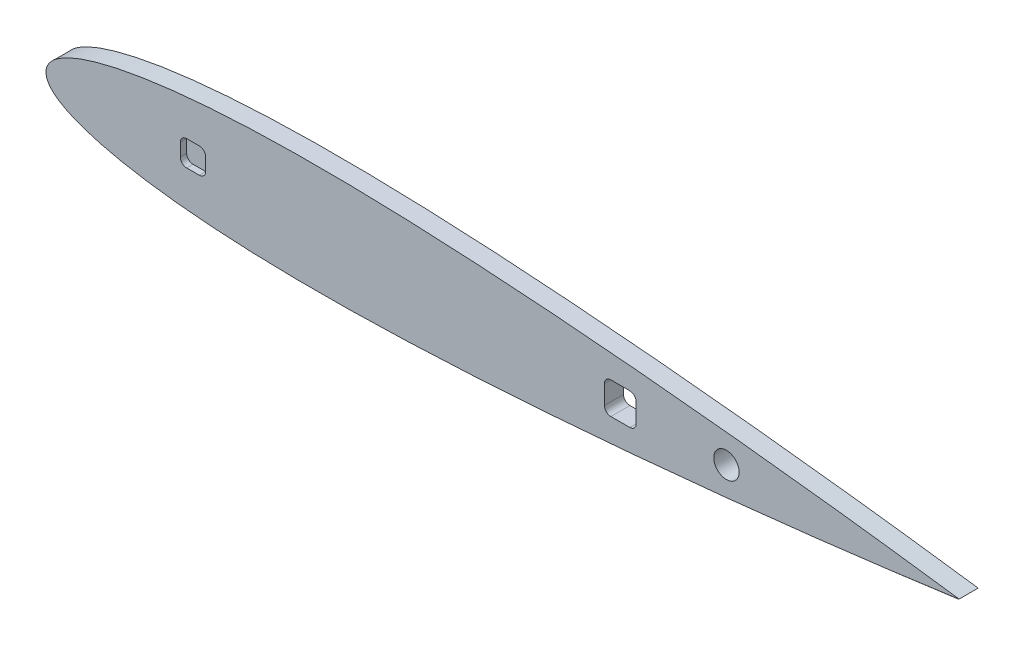
from build123d import *

# Parameters (mm, degrees)
ESBO_O2_R                = 4
RESSALTO_EXTRUS_O1_DEPTH = 6
CORTE_EXTRUS_O1_DEPTH    = 2
CORTE_EXTRUS_O2_DEPTH    = 2


with BuildPart() as part:
    # Esboço2 → Ressalto-extrusão1 (new body)
    with BuildSketch(Plane.XY):
        with BuildLine():
            add(Edge.make_bspline(
                [(287.6, 0), (287.6, 0.119697914), (285.817754553, 0.247185692), (284.767865992, 0.398094711), (284.264448894, 0.467820009), (283.43768813, 0.583773245), (282.277829485, 0.74507406), (280.793202236, 0.949881536), (278.98510147, 1.198450267), (276.858420544, 1.488091926), (274.417893217, 1.816930381), (271.669401999, 2.183559584), (268.619301696, 2.585347237), (265.274709704, 3.020406095), (261.643364865, 3.485243955), (257.733807871, 3.97868529), (253.555140371, 4.49727783), (249.117159969, 5.038339365), (244.430264247, 5.599454736), (239.5053681, 6.177691953), (234.353792881, 6.769587119), (228.987863488, 7.373628638), (223.419943837, 7.985483384), (217.663214551, 8.603508067), (211.730895239, 9.223286141), (205.636969584, 9.843669103), (199.39559532, 10.459873108), (193.021447659, 11.069962818), (186.529328525, 11.669700875), (179.934382421, 12.257126539), (173.252052511, 12.827383605), (166.497911298, 13.377921429), (159.687818769, 13.905224154), (152.837593287, 14.405058832), (145.963333172, 14.874290612), (139.081085422, 15.309171286), (132.20678029, 15.70550096), (125.35660044, 16.060145436), (118.546388357, 16.369233), (111.792105265, 16.629320446), (105.10962701, 16.837520337), (98.514511855, 16.990129218), (92.022156597, 17.084456768), (85.647566419, 17.117851746), (79.405754471, 17.088329774), (73.311328939, 16.994563536), (67.378571016, 16.833719315), (61.62120467, 16.606508882), (56.052663957, 16.311299689), (50.685913151, 15.948919147), (45.533589734, 15.519442809), (40.60767255, 15.02365128), (35.919607131, 14.463425319), (31.480201299, 13.841042083), (27.299913239, 13.157661743), (23.388323375, 12.416699746), (19.754434178, 11.620942186), (16.40673833, 10.773086642), (13.352633209, 9.876931334), (10.598853103, 8.935452398), (8.151270602, 7.951901503), (6.014730805, 6.929116001), (4.1933041, 5.869225283), (2.689111463, 4.774026072), (1.505059401, 3.641716827), (0.644003291, 2.469089904), (0.117552225, 1.250413641), (-0.057299877, 0), (0.117552225, -1.250413641), (0.644003291, -2.469089904), (1.505059401, -3.641716827), (2.689111463, -4.774026072), (4.1933041, -5.869225283), (6.014730805, -6.929116001), (8.151270602, -7.951901503), (10.598853103, -8.935452398), (13.352633209, -9.876931334), (16.40673833, -10.773086642), (19.754434178, -11.620942186), (23.388323375, -12.416699746), (27.299913239, -13.157661743), (31.480201299, -13.841042083), (35.919607131, -14.463425319), (40.60767255, -15.02365128), (45.533589734, -15.519442809), (50.685913151, -15.948919147), (56.052663957, -16.311299689), (61.62120467, -16.606508882), (67.378571016, -16.833719315), (73.311328939, -16.994563536), (79.405754471, -17.088329774), (85.647566419, -17.117851746), (92.022156597, -17.084456768), (98.514511855, -16.990129218), (105.10962701, -16.837520337), (111.792105265, -16.629320446), (118.546388357, -16.369233), (125.35660044, -16.060145436), (132.20678029, -15.70550096), (139.081085422, -15.309171286), (145.963333172, -14.874290612), (152.837593287, -14.405058832), (159.687818769, -13.905224154), (166.497911298, -13.377921429), (173.252052511, -12.827383605), (179.934382421, -12.257126539), (186.529328525, -11.669700875), (193.021447659, -11.069962818), (199.39559532, -10.459873108), (205.636969584, -9.843669103), (211.730895239, -9.223286141), (217.663214551, -8.603508067), (223.419943837, -7.985483384), (228.987863488, -7.373628638), (234.353792881, -6.769587119), (239.5053681, -6.177691953), (244.430264247, -5.599454736), (249.117159969, -5.038339365), (253.555140371, -4.49727783), (257.733807871, -3.97868529), (261.643364865, -3.485243955), (265.274709704, -3.020406095), (268.619301696, -2.585347237), (271.669401999, -2.183559584), (274.417893217, -1.816930381), (276.858420544, -1.488091926), (278.98510147, -1.198450267), (280.793202236, -0.949881536), (282.277829485, -0.74507406), (283.43768813, -0.583773245), (284.264448894, -0.467820009), (284.767865992, -0.398094711), (285.817754553, -0.247185692), (287.6, -0.119697914), (287.6, 0)],
                knots=[0, 0, 0, 0, 0.004404679, 0.004691332, 0.005550263, 0.00697996, 0.00897637, 0.011534826, 0.01464942, 0.018312468, 0.02251533, 0.027247507, 0.032497897, 0.038253958, 0.044502067, 0.051226869, 0.058413314, 0.066043467, 0.074098984, 0.082561952, 0.091411519, 0.100627009, 0.110186575, 0.120067575, 0.130246743, 0.140700547, 0.151404252, 0.162331842, 0.173458675, 0.18475829, 0.196204076, 0.207768618, 0.219425945, 0.231147635, 0.242906359, 0.254675296, 0.26642621, 0.278132455, 0.289766477, 0.301301814, 0.312711646, 0.323969259, 0.33505005, 0.345928599, 0.356580621, 0.366981996, 0.377109776, 0.386942119, 0.396457905, 0.405636645, 0.41445907, 0.42290662, 0.430962851, 0.438611618, 0.445838275, 0.452630377, 0.458976173, 0.4648663, 0.470293868, 0.475254829, 0.479749124, 0.483781006, 0.48736258, 0.490515632, 0.493278566, 0.495712194, 0.497909944, 0.5, 0.502090056, 0.504287806, 0.506721434, 0.509484368, 0.51263742, 0.516218994, 0.520250876, 0.524745171, 0.529706132, 0.5351337, 0.541023827, 0.547369623, 0.554161725, 0.561388382, 0.569037149, 0.57709338, 0.58554093, 0.594363355, 0.603542095, 0.613057881, 0.622890224, 0.633018004, 0.643419379, 0.654071401, 0.66494995, 0.676030741, 0.687288354, 0.698698186, 0.710233523, 0.721867545, 0.73357379, 0.745324704, 0.757093641, 0.768852365, 0.780574055, 0.792231382, 0.803795924, 0.81524171, 0.826541325, 0.837668158, 0.848595748, 0.859299453, 0.869753257, 0.879932425, 0.889813425, 0.899372991, 0.908588481, 0.917438048, 0.925901016, 0.933956533, 0.941586686, 0.948773131, 0.955497933, 0.961746042, 0.967502103, 0.972752493, 0.97748467, 0.981687532, 0.98535058, 0.988465174, 0.99102363, 0.99302004, 0.994449737, 0.995308668, 0.995595321, 1, 1, 1, 1], degree=3))
        make_face()
        with Locations((214.35, 0)):
            Circle(ESBO_O2_R, mode=Mode.SUBTRACT)
        with BuildLine():
            Line((183.933333333, -5), (177.933333333, -5))
            ThreePointArc((177.933333333, -5), (176.519119771, -4.414213562), (175.933333333, -3))
            Line((175.933333333, -3), (175.933333333, 3))
            ThreePointArc((175.933333333, 3), (176.519119771, 4.414213562), (177.933333333, 5))
            Line((177.933333333, 5), (183.933333333, 5))
            ThreePointArc((183.933333333, 5), (185.347546896, 4.414213562), (185.933333333, 3))
            Line((185.933333333, 3), (185.933333333, -3))
            ThreePointArc((185.933333333, -3), (185.347546896, -4.414213562), (183.933333333, -5))
        make_face(mode=Mode.SUBTRACT)
    extrude(amount=RESSALTO_EXTRUS_O1_DEPTH)

    # Esboço3 → Corte-extrusão1 (cut)
    with BuildSketch(Plane(origin=(0, 0, 0), x_dir=(-1, 0, 0), z_dir=(0, 0, -1))):
        with BuildLine():
            Line((-13, -4), (-17, -4))
            ThreePointArc((-17, -4), (-18.414213562, -3.414213562), (-19, -2))
            Line((-19, -2), (-19, 2))
            ThreePointArc((-19, 2), (-18.414213562, 3.414213562), (-17, 4))
            Line((-17, 4), (-13, 4))
            ThreePointArc((-13, 4), (-11.585786438, 3.414213562), (-11, 2))
            Line((-11, 2), (-11, -2))
            ThreePointArc((-11, -2), (-11.585786438, -3.414213562), (-13, -4))
        make_face()
    extrude(amount=-CORTE_EXTRUS_O1_DEPTH, mode=Mode.SUBTRACT)

    # Esboço4 → Corte-extrusão2 (cut)
    with BuildSketch(Plane.XY.offset(6)):
        with BuildLine():
            Line((44.3, -4), (48.3, -4))
            ThreePointArc((48.3, -4), (49.714213562, -3.414213562), (50.3, -2))
            Line((50.3, -2), (50.3, 2))
            ThreePointArc((50.3, 2), (49.714213562, 3.414213562), (48.3, 4))
            Line((48.3, 4), (44.3, 4))
            ThreePointArc((44.3, 4), (42.885786438, 3.414213562), (42.3, 2))
            Line((42.3, 2), (42.3, -2))
            ThreePointArc((42.3, -2), (42.885786438, -3.414213562), (44.3, -4))
        make_face()
    extrude(amount=-CORTE_EXTRUS_O2_DEPTH, mode=Mode.SUBTRACT)


solid = part.part
